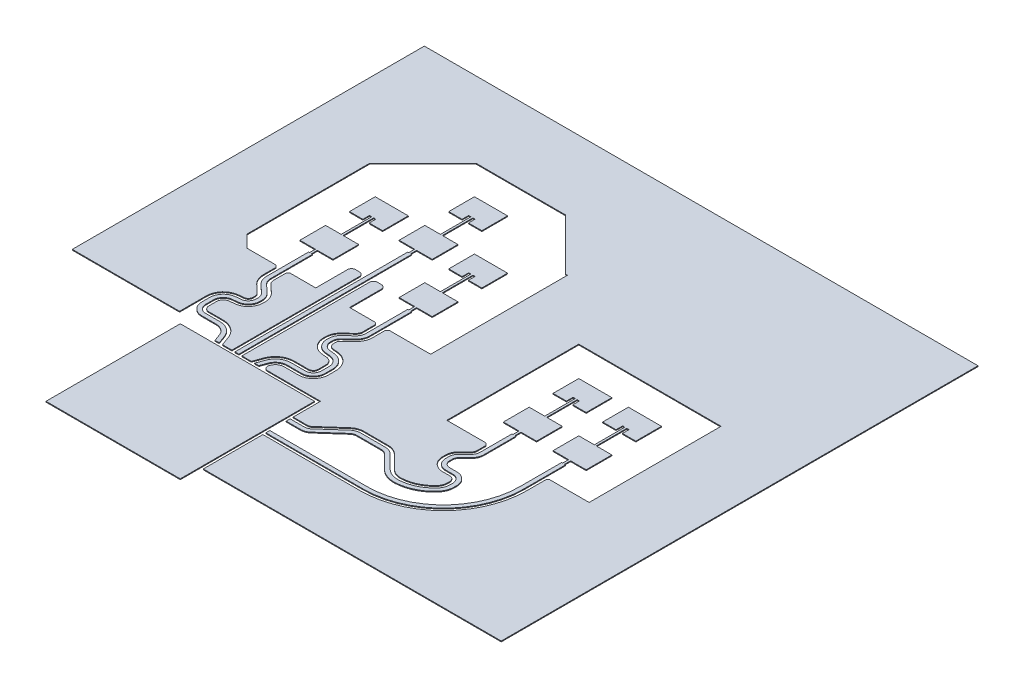
from build123d import *

# Parameters (mm, degrees)
BOSS_EXTRUDE1_DEPTH   = 0.0406
BOSS_EXTRUDE1_2_DEPTH = 0.0406
BOSS_EXTRUDE1_3_DEPTH = 0.0406
BOSS_EXTRUDE1_4_DEPTH = 0.0406
BOSS_EXTRUDE1_5_DEPTH = 0.0406
SKETCH2_W             = 6.76
SKETCH2_H             = 6.76
BOSS_EXTRUDE1_6_DEPTH = 0.0406
BOSS_EXTRUDE1_7_DEPTH = 0.0406
BOSS_EXTRUDE1_8_DEPTH = 0.0406
BOSS_EXTRUDE1_9_DEPTH = 0.0406


with BuildPart() as part:
    # Sketch2 → Boss-Extrude1 (new body)
    with BuildSketch(Plane(origin=(0, 0, 0), x_dir=(1, 0, 0), z_dir=(0, 1, 0))):
        with BuildLine():
            Line((0, 0), (0.783, 0))
            Line((0.783, 0), (0.783, -0.3))
            Line((0.783, -0.3), (0.733, -0.3))
            Line((0.733, -0.3), (0.733, -1.681))
            Line((0.733, -1.681), (0.733, -2.41))
            ThreePointArc((0.733, -2.41), (0.789551412, -2.681881398), (0.949824909, -2.90866315))
            Line((0.949824909, -2.90866315), (1.333799344, -3.266725104))
            ThreePointArc((1.333799344, -3.266725104), (1.42782403, -3.399766957), (1.461, -3.559266585))
            Line((1.461, -3.559266585), (1.461, -3.659266585))
            ThreePointArc((1.461, -3.659266585), (1.355910935, -3.929502668), (1.095862297, -4.057744464))
            Line((1.095862297, -4.057744464), (0.85999098, -4.07838053))
            ThreePointArc((0.85999098, -4.07838053), (0.404905864, -4.302803674), (0.221, -4.775716819))
            Line((0.221, -4.775716819), (0.221, -5.162))
            ThreePointArc((0.221, -5.162), (0.396735931, -5.586264069), (0.821, -5.762))
            Line((0.821, -5.762), (1.540119726, -5.762))
            ThreePointArc((1.540119726, -5.762), (1.884265588, -5.870508773), (2.103935299, -6.156787914))
            Line((2.103935299, -6.156787914), (2.229582223, -6.502))
            Line((2.229582223, -6.502), (2.442417777, -6.502))
            Line((2.442417777, -6.502), (2.291873823, -6.088383885))
            ThreePointArc((2.291873823, -6.088383885), (1.998980876, -5.706678365), (1.540119726, -5.562))
            Line((1.540119726, -5.562), (0.821, -5.562))
            ThreePointArc((0.821, -5.562), (0.538157288, -5.444842712), (0.421, -5.162))
            Line((0.421, -5.162), (0.421, -4.775716819))
            ThreePointArc((0.421, -4.775716819), (0.552361332, -4.437921715), (0.877422129, -4.27761947))
            Line((0.877422129, -4.27761947), (1.113293446, -4.256983404))
            ThreePointArc((1.113293446, -4.256983404), (1.503366402, -4.064620709), (1.661, -3.659266585))
            Line((1.661, -3.659266585), (1.661, -3.559266585))
            ThreePointArc((1.661, -3.559266585), (1.611236045, -3.320017143), (1.470199016, -3.120454364))
            Line((1.470199016, -3.120454364), (1.086224581, -2.76239241))
            ThreePointArc((1.086224581, -2.76239241), (0.972963427, -2.602131584), (0.933, -2.41))
            Line((0.933, -2.41), (0.933, -1.181621959))
            Line((0.933, -1.181621959), (0.933, -0.3))
            Line((0.933, -0.3), (0.883, -0.3))
            Line((0.883, -0.3), (0.883, 0))
            Line((0.883, 0), (1.666, 0))
            Line((1.666, 0), (1.666, 1.294))
            Line((1.666, 1.294), (0.883, 1.294))
            Line((0.883, 1.294), (0.883, 2.8313))
            Line((0.883, 2.8313), (0.994, 2.8313))
            Line((0.994, 2.8313), (0.994, 2.498))
            Line((0.994, 2.498), (1.666, 2.498))
            Line((1.666, 2.498), (1.666, 3.792))
            Line((1.666, 3.792), (0, 3.792))
            Line((0, 3.792), (0, 2.498))
            Line((0, 2.498), (0.672, 2.498))
            Line((0.672, 2.498), (0.672, 2.8313))
            Line((0.672, 2.8313), (0.783, 2.8313))
            Line((0.783, 2.8313), (0.783, 1.294))
            Line((0.783, 1.294), (0, 1.294))
            Line((0, 1.294), (0, 0))
        make_face()
    extrude(amount=BOSS_EXTRUDE1_DEPTH)


with BuildPart() as body_2:
    # Sketch2 → Boss-Extrude1 2 (new body)
    with BuildSketch(Plane(origin=(0, 0, 0), x_dir=(1, 0, 0), z_dir=(0, 1, 0))):
        Polygon((2.498, 6.29), (2.498, 4.996), (3.17, 4.996), (3.17, 5.3293), (3.281, 5.3293), (3.281, 3.792), (2.498, 3.792), (2.498, 2.498), (3.281, 2.498), (3.281, 2.198), (3.231, 2.198), (3.231, -6.502), (3.431, -6.502), (3.431, 2.198), (3.381, 2.198), (3.381, 2.498), (4.164, 2.498), (4.164, 3.792), (3.381, 3.792), (3.381, 5.3293), (3.492, 5.3293), (3.492, 4.996), (4.164, 4.996), (4.164, 6.29), align=None)
    extrude(amount=BOSS_EXTRUDE1_2_DEPTH)


with BuildPart() as body_3:
    # Sketch2 → Boss-Extrude1 3 (new body)
    with BuildSketch(Plane(origin=(0, 0, 0), x_dir=(1, 0, 0), z_dir=(0, 1, 0))):
        with BuildLine():
            Line((5.668, 2.8313), (5.779, 2.8313))
            Line((5.779, 2.8313), (5.779, 1.294))
            Line((5.779, 1.294), (4.996, 1.294))
            Line((4.996, 1.294), (4.996, 0))
            Line((4.996, 0), (5.779, 0))
            Line((5.779, 0), (5.779, -0.3))
            Line((5.779, -0.3), (5.729, -0.3))
            Line((5.729, -0.3), (5.729, -1.181621959))
            Line((5.729, -1.181621959), (5.729, -2.41))
            ThreePointArc((5.729, -2.41), (5.689036573, -2.602131584), (5.575775419, -2.76239241))
            Line((5.575775419, -2.76239241), (5.191800984, -3.120454364))
            ThreePointArc((5.191800984, -3.120454364), (5.050763955, -3.320017143), (5.001, -3.559266585))
            Line((5.001, -3.559266585), (5.001, -3.659266585))
            ThreePointArc((5.001, -3.659266585), (5.158633598, -4.064620709), (5.548706554, -4.256983404))
            Line((5.548706554, -4.256983404), (5.784577871, -4.27761947))
            ThreePointArc((5.784577871, -4.27761947), (6.109638668, -4.437921715), (6.241, -4.775716819))
            Line((6.241, -4.775716819), (6.241, -5.162))
            ThreePointArc((6.241, -5.162), (6.123842712, -5.444842712), (5.841, -5.562))
            Line((5.841, -5.562), (5.121880274, -5.562))
            ThreePointArc((5.121880274, -5.562), (4.663019124, -5.706678365), (4.370126177, -6.088383885))
            Line((4.370126177, -6.088383885), (4.219582223, -6.502))
            Line((4.219582223, -6.502), (4.432417777, -6.502))
            Line((4.432417777, -6.502), (4.558064701, -6.156787914))
            ThreePointArc((4.558064701, -6.156787914), (4.777734412, -5.870508773), (5.121880274, -5.762))
            Line((5.121880274, -5.762), (5.841, -5.762))
            ThreePointArc((5.841, -5.762), (6.265264069, -5.586264069), (6.441, -5.162))
            Line((6.441, -5.162), (6.441, -4.775716819))
            ThreePointArc((6.441, -4.775716819), (6.257094136, -4.302803674), (5.80200902, -4.07838053))
            Line((5.80200902, -4.07838053), (5.566137703, -4.057744464))
            ThreePointArc((5.566137703, -4.057744464), (5.306089065, -3.929502668), (5.201, -3.659266585))
            Line((5.201, -3.659266585), (5.201, -3.559266585))
            ThreePointArc((5.201, -3.559266585), (5.23417597, -3.399766957), (5.328200656, -3.266725104))
            Line((5.328200656, -3.266725104), (5.712175091, -2.90866315))
            ThreePointArc((5.712175091, -2.90866315), (5.872448588, -2.681881398), (5.929, -2.41))
            Line((5.929, -2.41), (5.929, -1.681))
            Line((5.929, -1.681), (5.929, -0.3))
            Line((5.929, -0.3), (5.879, -0.3))
            Line((5.879, -0.3), (5.879, 0))
            Line((5.879, 0), (6.662, 0))
            Line((6.662, 0), (6.662, 1.294))
            Line((6.662, 1.294), (5.879, 1.294))
            Line((5.879, 1.294), (5.879, 2.8313))
            Line((5.879, 2.8313), (5.99, 2.8313))
            Line((5.99, 2.8313), (5.99, 2.498))
            Line((5.99, 2.498), (6.662, 2.498))
            Line((6.662, 2.498), (6.662, 3.792))
            Line((6.662, 3.792), (4.996, 3.792))
            Line((4.996, 3.792), (4.996, 2.498))
            Line((4.996, 2.498), (5.668, 2.498))
            Line((5.668, 2.498), (5.668, 2.8313))
        make_face()
    extrude(amount=BOSS_EXTRUDE1_3_DEPTH)


with BuildPart() as body_4:
    # Sketch2 → Boss-Extrude1 4 (new body)
    with BuildSketch(Plane(origin=(0, 0, 0), x_dir=(1, 0, 0), z_dir=(0, 1, 0))):
        with BuildLine():
            Line((13.721, 0.0293), (13.832, 0.0293))
            Line((13.832, 0.0293), (13.832, -1.508))
            Line((13.832, -1.508), (13.049, -1.508))
            Line((13.049, -1.508), (13.049, -2.802))
            Line((13.049, -2.802), (13.832, -2.802))
            Line((13.832, -2.802), (13.832, -3.102))
            Line((13.832, -3.102), (13.782, -3.102))
            Line((13.782, -3.102), (13.782, -4.720658284))
            ThreePointArc((13.782, -4.720658284), (13.751551813, -4.873731657), (13.664842712, -5.003500996))
            Line((13.664842712, -5.003500996), (13.328446609, -5.339897099))
            ThreePointArc((13.328446609, -5.339897099), (13.220060234, -5.502108774), (13.182, -5.69345049))
            Line((13.182, -5.69345049), (13.182, -5.847534405))
            ThreePointArc((13.182, -5.847534405), (13.328446609, -6.201087795), (13.682, -6.347534405))
            Line((13.682, -6.347534405), (14.045603897, -6.347534405))
            ThreePointArc((14.045603897, -6.347534405), (14.328446609, -6.464691692), (14.445603897, -6.747534405))
            Line((14.445603897, -6.747534405), (14.445603897, -6.867534405))
            ThreePointArc((14.445603897, -6.867534405), (14.400117031, -7.115753175), (14.269568018, -7.331712819))
            ThreePointArc((14.269568018, -7.331712819), (13.661261862, -7.788656355), (12.922456401, -7.970316108))
            ThreePointArc((12.922456401, -7.970316108), (12.558976924, -7.90915416), (12.250497645, -7.707415098))
            Line((12.250497645, -7.707415098), (11.590818479, -7.047735931))
            ThreePointArc((11.590818479, -7.047735931), (11.39616447, -6.91767228), (11.16655441, -6.872))
            Line((11.16655441, -6.872), (9.935857435, -6.872))
            ThreePointArc((9.935857435, -6.872), (9.722303865, -6.911290741), (9.536719222, -7.024017091))
            Line((9.536719222, -7.024017091), (8.519130834, -7.930655273))
            ThreePointArc((8.519130834, -7.930655273), (8.395407738, -8.005806172), (8.253038692, -8.032))
            Line((8.253038692, -8.032), (7.541, -8.032))
            Line((7.541, -8.032), (7.541, -8.132))
            Line((7.541, -8.132), (7.541, -8.232))
            Line((7.541, -8.232), (8.253038692, -8.232))
            ThreePointArc((8.253038692, -8.232), (8.466592262, -8.192709259), (8.652176905, -8.079982909))
            Line((8.652176905, -8.079982909), (9.669765293, -7.173344727))
            ThreePointArc((9.669765293, -7.173344727), (9.793488388, -7.098193828), (9.935857435, -7.072))
            Line((9.935857435, -7.072), (11.16655441, -7.072))
            ThreePointArc((11.16655441, -7.072), (11.319627783, -7.102448187), (11.449397123, -7.189157288))
            Line((11.449397123, -7.189157288), (12.109076289, -7.848836454))
            ThreePointArc((12.109076289, -7.848836454), (12.486106518, -8.095406419), (12.930359213, -8.170159911))
            ThreePointArc((12.930359213, -8.170159911), (13.746933669, -7.969378078), (14.419272052, -7.464335223))
            ThreePointArc((14.419272052, -7.464335223), (14.587120783, -7.186672823), (14.645603897, -6.867534405))
            Line((14.645603897, -6.867534405), (14.645603897, -6.747534405))
            ThreePointArc((14.645603897, -6.747534405), (14.469867966, -6.323270336), (14.045603897, -6.147534405))
            Line((14.045603897, -6.147534405), (13.682, -6.147534405))
            ThreePointArc((13.682, -6.147534405), (13.469867966, -6.059666439), (13.382, -5.847534405))
            Line((13.382, -5.847534405), (13.382, -5.69345049))
            ThreePointArc((13.382, -5.69345049), (13.40483614, -5.57864546), (13.469867966, -5.481318456))
            Line((13.469867966, -5.481318456), (13.806264069, -5.144922353))
            ThreePointArc((13.806264069, -5.144922353), (13.93632772, -4.950268343), (13.982, -4.720658284))
            Line((13.982, -4.720658284), (13.982, -3.102))
            Line((13.982, -3.102), (13.932, -3.102))
            Line((13.932, -3.102), (13.932, -2.802))
            Line((13.932, -2.802), (14.715, -2.802))
            Line((14.715, -2.802), (14.715, -1.508))
            Line((14.715, -1.508), (13.932, -1.508))
            Line((13.932, -1.508), (13.932, 0.0293))
            Line((13.932, 0.0293), (14.043, 0.0293))
            Line((14.043, 0.0293), (14.043, -0.304))
            Line((14.043, -0.304), (14.715, -0.304))
            Line((14.715, -0.304), (14.715, 0.99))
            Line((14.715, 0.99), (13.049, 0.99))
            Line((13.049, 0.99), (13.049, -0.304))
            Line((13.049, -0.304), (13.721, -0.304))
            Line((13.721, -0.304), (13.721, 0.0293))
        make_face()
    extrude(amount=BOSS_EXTRUDE1_4_DEPTH)


with BuildPart() as body_5:
    # Sketch2 → Boss-Extrude1 5 (new body)
    with BuildSketch(Plane(origin=(0, 0, 0), x_dir=(1, 0, 0), z_dir=(0, 1, 0))):
        with BuildLine():
            Line((16.33, -1.508), (16.33, 0.0293))
            Line((16.33, 0.0293), (16.219, 0.0293))
            Line((16.219, 0.0293), (16.219, -0.304))
            Line((16.219, -0.304), (15.547, -0.304))
            Line((15.547, -0.304), (15.547, 0.99))
            Line((15.547, 0.99), (17.213, 0.99))
            Line((17.213, 0.99), (17.213, -0.304))
            Line((17.213, -0.304), (16.541, -0.304))
            Line((16.541, -0.304), (16.541, 0.0293))
            Line((16.541, 0.0293), (16.43, 0.0293))
            Line((16.43, 0.0293), (16.43, -1.508))
            Line((16.43, -1.508), (17.213, -1.508))
            Line((17.213, -1.508), (17.213, -2.802))
            Line((17.213, -2.802), (16.43, -2.802))
            Line((16.43, -2.802), (16.43, -3.102))
            Line((16.43, -3.102), (16.48, -3.102))
            Line((16.48, -3.102), (16.48, -5.213))
            ThreePointArc((16.48, -5.213), (15.297004289, -8.069004289), (12.441, -9.252))
            Line((12.441, -9.252), (7.541, -9.252))
            Line((7.541, -9.252), (7.541, -9.052))
            Line((7.541, -9.052), (12.441, -9.052))
            ThreePointArc((12.441, -9.052), (15.155582933, -7.927582933), (16.28, -5.213))
            Line((16.28, -5.213), (16.28, -3.102))
            Line((16.28, -3.102), (16.33, -3.102))
            Line((16.33, -3.102), (16.33, -2.802))
            Line((16.33, -2.802), (15.547, -2.802))
            Line((15.547, -2.802), (15.547, -1.508))
            Line((15.547, -1.508), (16.33, -1.508))
        make_face()
    extrude(amount=BOSS_EXTRUDE1_5_DEPTH)


with BuildPart() as body_6:
    # Sketch2 → Boss-Extrude1 6 (new body)
    with BuildSketch(Plane(origin=(0, 0, 0), x_dir=(1, 0, 0), z_dir=(0, 1, 0))):
        with Locations((4.011, -10.032)):
            Rectangle(SKETCH2_W, SKETCH2_H)
    extrude(amount=BOSS_EXTRUDE1_6_DEPTH)


with BuildPart() as body_7:
    # Sketch2 → Boss-Extrude1 7 (new body)
    with BuildSketch(Plane(origin=(0, 0, 0), x_dir=(1, 0, 0), z_dir=(0, 1, 0))):
        with BuildLine():
            Line((8.262, -1.681), (8.262, 5.209))
            Line((8.262, 5.209), (8.162, 5.209))
            Line((8.162, 5.209), (5.581, 7.79))
            Line((5.581, 7.79), (1.081, 7.79))
            Line((1.081, 7.79), (-1.6, 5.109))
            Line((-1.6, 5.109), (-1.6, -1.071))
            Line((-1.6, -1.071), (-0.99, -1.681))
            Line((-0.99, -1.681), (0.481, -1.681))
            Line((0.481, -1.681), (0.581, -1.781))
            Line((0.581, -1.781), (0.581, -2.41))
            ThreePointArc((0.581, -2.41), (0.650158281, -2.742491257), (0.846161158, -3.019828913))
            Line((0.846161158, -3.019828913), (1.230135593, -3.377890867))
            ThreePointArc((1.230135593, -3.377890867), (1.288430898, -3.460376816), (1.309, -3.559266585))
            Line((1.309, -3.559266585), (1.309, -3.659266585))
            ThreePointArc((1.309, -3.659266585), (1.24384478, -3.826812956), (1.082614624, -3.90632287))
            Line((1.082614624, -3.90632287), (0.846743307, -3.926958936))
            ThreePointArc((0.846743307, -3.926958936), (0.292839709, -4.200113962), (0.069, -4.775716819))
            Line((0.069, -4.775716819), (0.069, -6.125716819))
            Line((0.069, -6.125716819), (-5.331, -6.125716819))
            Line((-5.331, -6.125716819), (-5.331, 11.596))
            Line((-5.331, 11.596), (22.541, 11.596))
            Line((22.541, 11.596), (22.541, -12.404))
            Line((22.541, -12.404), (7.541, -12.404))
            Line((7.541, -12.404), (7.541, -9.404))
            Line((7.541, -9.404), (12.441, -9.404))
            ThreePointArc((12.441, -9.404), (15.40448452, -8.17648452), (16.632, -5.213))
            Line((16.632, -5.213), (16.632, -4.252))
            Line((16.632, -4.252), (16.732, -4.152))
            Line((16.732, -4.152), (18.713, -4.152))
            Line((18.713, -4.152), (18.713, 2.49))
            Line((18.713, 2.49), (11.549, 2.49))
            Line((11.549, 2.49), (11.549, -4.152))
            Line((11.549, -4.152), (13.53, -4.152))
            Line((13.53, -4.152), (13.63, -4.252))
            Line((13.63, -4.252), (13.63, -4.720658284))
            ThreePointArc((13.63, -4.720658284), (13.611122124, -4.815563775), (13.557362482, -4.896020766))
            Line((13.557362482, -4.896020766), (13.220966379, -5.232416869))
            ThreePointArc((13.220966379, -5.232416869), (13.079630545, -5.443940892), (13.03, -5.69345049))
            Line((13.03, -5.69345049), (13.03, -5.847534405))
            ThreePointArc((13.03, -5.847534405), (13.220966379, -6.308568026), (13.682, -6.499534405))
            Line((13.682, -6.499534405), (14.045603897, -6.499534405))
            ThreePointArc((14.045603897, -6.499534405), (14.220966379, -6.572171923), (14.293603897, -6.747534405))
            Line((14.293603897, -6.747534405), (14.293603897, -6.867534405))
            ThreePointArc((14.293603897, -6.867534405), (14.257994179, -7.061854242), (14.155792951, -7.230919792))
            ThreePointArc((14.155792951, -7.230919792), (13.596151288, -7.651307845), (12.916450264, -7.818434818))
            ThreePointArc((12.916450264, -7.818434818), (12.614358432, -7.767602443), (12.357977876, -7.599934867))
            Line((12.357977876, -7.599934867), (11.69829871, -6.940255701))
            ThreePointArc((11.69829871, -6.940255701), (11.454332351, -6.777242592), (11.16655441, -6.72))
            Line((11.16655441, -6.72), (9.935857435, -6.72))
            ThreePointArc((9.935857435, -6.72), (9.668203627, -6.769244396), (9.435604208, -6.910528087))
            Line((9.435604208, -6.910528087), (8.41801582, -7.817166269))
            ThreePointArc((8.41801582, -7.817166269), (8.341307501, -7.863759827), (8.253038692, -7.88))
            Line((8.253038692, -7.88), (7.541, -7.88))
            Line((7.541, -7.88), (7.541, -6.502))
            Line((7.541, -6.502), (4.8798024, -6.502))
            ThreePointArc((4.8798024, -6.502), (4.715971991, -6.416715287), (4.691863876, -6.233595971))
            Line((4.691863876, -6.233595971), (4.700897979, -6.208774976))
            ThreePointArc((4.700897979, -6.208774976), (4.86491803, -5.995019884), (5.121880274, -5.914))
            Line((5.121880274, -5.914), (5.841, -5.914))
            ThreePointArc((5.841, -5.914), (6.372744299, -5.693744299), (6.593, -5.162))
            Line((6.593, -5.162), (6.593, -4.775716819))
            ThreePointArc((6.593, -4.775716819), (6.369160291, -4.200113962), (5.815256693, -3.926958936))
            Line((5.815256693, -3.926958936), (5.579385376, -3.90632287))
            ThreePointArc((5.579385376, -3.90632287), (5.41815522, -3.826812956), (5.353, -3.659266585))
            Line((5.353, -3.659266585), (5.353, -3.559266585))
            ThreePointArc((5.353, -3.559266585), (5.373569102, -3.460376816), (5.431864407, -3.377890867))
            Line((5.431864407, -3.377890867), (5.815838842, -3.019828913))
            ThreePointArc((5.815838842, -3.019828913), (6.011841719, -2.742491257), (6.081, -2.41))
            Line((6.081, -2.41), (6.081, -1.781))
            Line((6.081, -1.781), (6.181, -1.681))
            Line((6.181, -1.681), (8.262, -1.681))
        make_face()
    extrude(amount=BOSS_EXTRUDE1_7_DEPTH)


with BuildPart() as body_8:
    # Sketch2 → Boss-Extrude1 8 (new body)
    with BuildSketch(Plane(origin=(0, 0, 0), x_dir=(1, 0, 0), z_dir=(0, 1, 0))):
        with BuildLine():
            Line((1.085, -1.781), (1.085, -2.41))
            ThreePointArc((1.085, -2.41), (1.112356558, -2.541521726), (1.189888331, -2.651226647))
            Line((1.189888331, -2.651226647), (1.573862767, -3.009288601))
            ThreePointArc((1.573862767, -3.009288601), (1.750629176, -3.259407285), (1.813, -3.559266585))
            Line((1.813, -3.559266585), (1.813, -3.659266585))
            ThreePointArc((1.813, -3.659266585), (1.615432557, -4.167310421), (1.126541119, -4.408404998))
            Line((1.126541119, -4.408404998), (0.890669802, -4.429041064))
            ThreePointArc((0.890669802, -4.429041064), (0.664427487, -4.540611427), (0.573, -4.775716819))
            Line((0.573, -4.775716819), (0.573, -5.162))
            ThreePointArc((0.573, -5.162), (0.645637518, -5.337362482), (0.821, -5.41))
            Line((0.821, -5.41), (1.540119726, -5.41))
            ThreePointArc((1.540119726, -5.41), (2.086164494, -5.582167254), (2.434707101, -6.036396824))
            Line((2.434707101, -6.036396824), (2.604172799, -6.502))
            Line((2.604172799, -6.502), (3.079, -6.502))
            Line((3.079, -6.502), (3.079, -0.081))
            ThreePointArc((3.079, -0.081), (3.020421356, 0.060421356), (2.879, 0.119))
            Line((2.879, 0.119), (2.679, 0.119))
            ThreePointArc((2.679, 0.119), (2.537578644, 0.060421356), (2.479, -0.081))
            Line((2.479, -0.081), (2.479, -1.681))
            Line((2.479, -1.681), (1.185, -1.681))
            Line((1.185, -1.681), (1.085, -1.781))
        make_face()
    extrude(amount=BOSS_EXTRUDE1_8_DEPTH)


with BuildPart() as body_9:
    # Sketch2 → Boss-Extrude1 9 (new body)
    with BuildSketch(Plane(origin=(0, 0, 0), x_dir=(1, 0, 0), z_dir=(0, 1, 0))):
        with BuildLine():
            Line((4.183, -1.681), (5.477, -1.681))
            Line((5.477, -1.681), (5.577, -1.781))
            Line((5.577, -1.781), (5.577, -2.41))
            ThreePointArc((5.577, -2.41), (5.549643442, -2.541521726), (5.472111669, -2.651226647))
            Line((5.472111669, -2.651226647), (5.088137233, -3.009288601))
            ThreePointArc((5.088137233, -3.009288601), (4.911370824, -3.259407285), (4.849, -3.559266585))
            Line((4.849, -3.559266585), (4.849, -3.659266585))
            ThreePointArc((4.849, -3.659266585), (5.046567443, -4.167310421), (5.535458881, -4.408404998))
            Line((5.535458881, -4.408404998), (5.771330198, -4.429041064))
            ThreePointArc((5.771330198, -4.429041064), (5.997572513, -4.540611427), (6.089, -4.775716819))
            Line((6.089, -4.775716819), (6.089, -5.162))
            ThreePointArc((6.089, -5.162), (6.016362482, -5.337362482), (5.841, -5.41))
            Line((5.841, -5.41), (5.121880274, -5.41))
            ThreePointArc((5.121880274, -5.41), (4.575835506, -5.582167254), (4.227292899, -6.036396824))
            Line((4.227292899, -6.036396824), (4.057827201, -6.502))
            Line((4.057827201, -6.502), (3.583, -6.502))
            Line((3.583, -6.502), (3.583, -0.081))
            ThreePointArc((3.583, -0.081), (3.641578644, 0.060421356), (3.783, 0.119))
            Line((3.783, 0.119), (3.983, 0.119))
            ThreePointArc((3.983, 0.119), (4.124421356, 0.060421356), (4.183, -0.081))
            Line((4.183, -0.081), (4.183, -1.681))
        make_face()
    extrude(amount=BOSS_EXTRUDE1_9_DEPTH)


solid = Compound([part.part, body_2.part, body_3.part, body_4.part, body_5.part, body_6.part, body_7.part, body_8.part, body_9.part])
